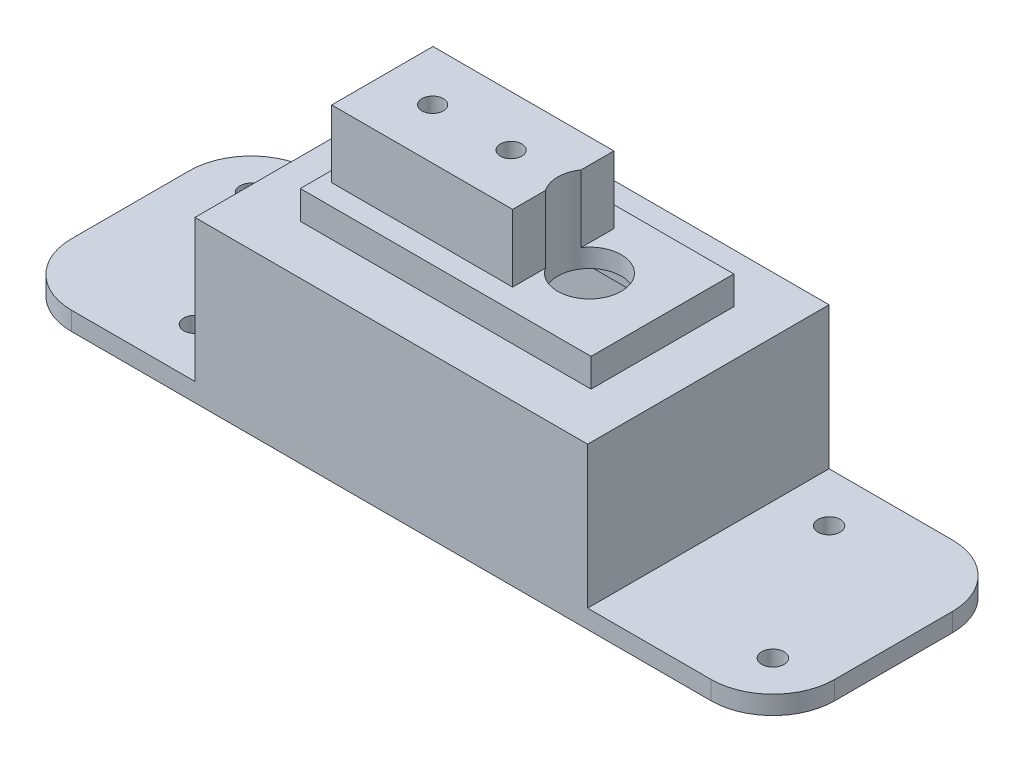
from build123d import *

# Parameters (mm, degrees)
SKETCH1_W           = 63.6
SKETCH1_H           = 39.1
BOSS_EXTRUDE1_DEPTH = 23
SKETCH3_W           = 47.08
SKETCH3_H           = 23.12
BOSS_EXTRUDE2_DEPTH = 4.6
SKETCH4_W           = 29.3
SKETCH4_H           = 16.4
BOSS_EXTRUDE3_DEPTH = 10.9
SHELL1_T            = -3
SKETCH5_W           = 123.6
SKETCH5_H           = 39.1
BOSS_EXTRUDE4_DEPTH = 3
SKETCH6_R           = 1.73
CUT_EXTRUDE1_DEPTH  = 110.599361312
SKETCH7_W           = 57.6
SKETCH7_H           = 33.1
CUT_EXTRUDE2_DEPTH  = 3
SKETCH8_R           = 1.8
CUT_EXTRUDE3_DEPTH  = 3
FILLET1_R           = 10
SKETCH9_R           = 5.15
CUT_EXTRUDE4_DEPTH  = 10
SKETCH12_R          = 5.15
CUT_EXTRUDE5_DEPTH  = 110.599361312


with BuildPart() as part:
    # Sketch1 → Boss-Extrude1 (new body)
    with BuildSketch(Plane(origin=(0, 0, 0), x_dir=(1, 0, 0), z_dir=(0, 1, 0))):
        with Locations((31.8, 19.55)):
            Rectangle(SKETCH1_W, SKETCH1_H)
    extrude(amount=BOSS_EXTRUDE1_DEPTH)

    # Sketch3 → Boss-Extrude2 (add)
    with BuildSketch(Plane(origin=(0, 23, 0), x_dir=(1, 0, 0), z_dir=(0, 1, 0))):
        with Locations((32.62, 19.55)):
            Rectangle(SKETCH3_W, SKETCH3_H)
    extrude(amount=BOSS_EXTRUDE2_DEPTH)

    # Sketch4 → Boss-Extrude3 (add)
    with BuildSketch(Plane(origin=(0, 27.6, 0), x_dir=(1, 0, 0), z_dir=(0, 1, 0))):
        with Locations((25.45, 19.55)):
            Rectangle(SKETCH4_W, SKETCH4_H)
    extrude(amount=BOSS_EXTRUDE3_DEPTH)

    # Shell1
    shell1_openings = [part.faces().sort_by_distance(p)[0] for p in [
        (31.8, 0, -19.55),
    ]]
    offset(amount=SHELL1_T, openings=shell1_openings, kind=Kind.INTERSECTION)

    # Sketch5 → Boss-Extrude4 (add)
    with BuildSketch(Plane.XZ):
        with Locations((31.8, -19.55)):
            Rectangle(SKETCH5_W, SKETCH5_H)
    extrude(amount=BOSS_EXTRUDE4_DEPTH)

    # Sketch6 → Cut-Extrude1 (cut, through all)
    with BuildSketch(Plane(origin=(0, 38.5, 0), x_dir=(1, 0, 0), z_dir=(0, 1, 0))):
        with Locations(Location((18.95, 19.55, 0), (0, 0, 270))):
            Circle(SKETCH6_R)
        with Locations(Location((31.65, 19.55, 0), (0, 0, 270))):
            Circle(SKETCH6_R)
    extrude(amount=-CUT_EXTRUDE1_DEPTH, mode=Mode.SUBTRACT)

    # Sketch7 → Cut-Extrude2 (cut)
    with BuildSketch(Plane.XZ.offset(3)):
        with Locations((31.8, -19.55)):
            Rectangle(SKETCH7_W, SKETCH7_H)
    extrude(amount=-CUT_EXTRUDE2_DEPTH, mode=Mode.SUBTRACT)

    # Sketch8 → Cut-Extrude3 (cut)
    with BuildSketch(Plane(origin=(0, 0, 0), x_dir=(1, 0, 0), z_dir=(0, 1, 0))):
        with Locations(Location((85.6, 8, 0), (0, 0, 270))):
            Circle(SKETCH8_R)
        with Locations(Location((71.6, 31.1, 0), (0, 0, 270))):
            Circle(SKETCH8_R)
        with Locations(Location((-8, 8, 0), (0, 0, 270))):
            Circle(SKETCH8_R)
        with Locations(Location((-22, 31.1, 0), (0, 0, 270))):
            Circle(SKETCH8_R)
    extrude(amount=-CUT_EXTRUDE3_DEPTH, mode=Mode.SUBTRACT)

    # Fillet1
    fillet1_edges = [part.edges().sort_by_distance(p)[0] for p in [
        (93.6, -1.5, -39.1),
        (93.6, -1.5, 0),
        (-30, -1.5, 0),
        (-30, -1.5, -39.1),
    ]]
    fillet(fillet1_edges, radius=FILLET1_R)

    # Sketch9 → Cut-Extrude4 (cut)
    with BuildSketch(Plane(origin=(0, 27.6, 0), x_dir=(1, 0, 0), z_dir=(0, 1, 0))):
        with Locations(Location((44.35, 19.55, 0), (0, 0, 214.386893027))):
            Circle(SKETCH9_R)
    extrude(amount=-CUT_EXTRUDE4_DEPTH, mode=Mode.SUBTRACT)

    # Sketch12 → Cut-Extrude5 (cut, through all)
    with BuildSketch(Plane(origin=(0, 38.5, 0), x_dir=(1, 0, 0), z_dir=(0, 1, 0))):
        with Locations(Location((44.35, 19.55, 0), (0, 0, 214.386893027))):
            Circle(SKETCH12_R)
    extrude(amount=-CUT_EXTRUDE5_DEPTH, mode=Mode.SUBTRACT)


solid = part.part
